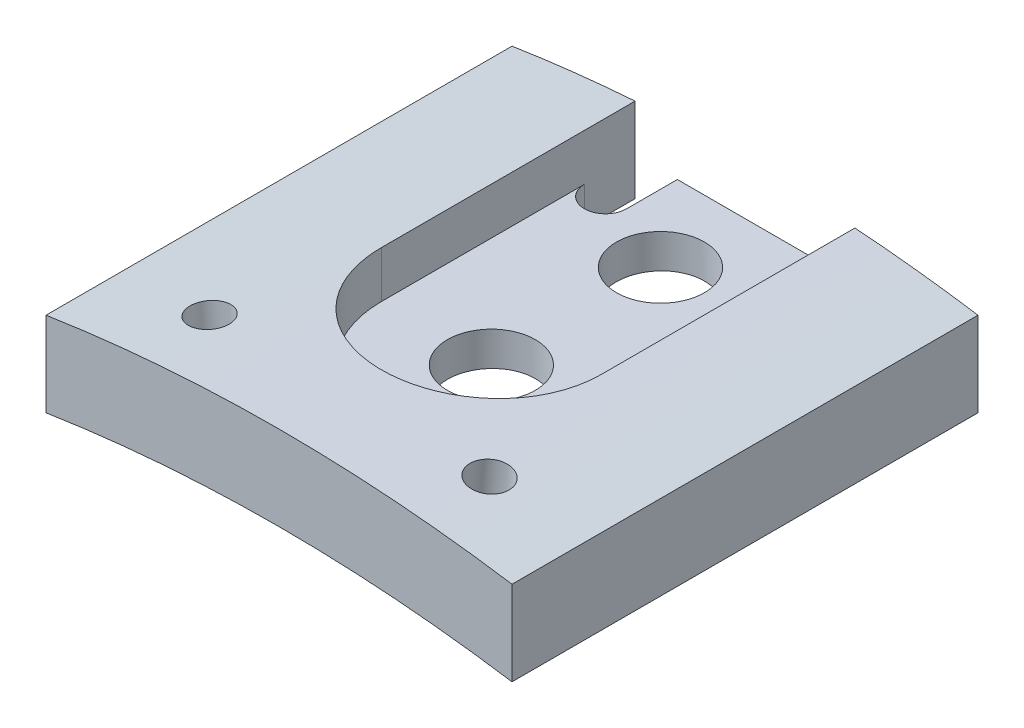
from build123d import *

# Parameters (mm, degrees)
BOSS_EXTRUDE1_DEPTH     = 35
CUT_EXTRUDE4_DEPTH      = 51.280392475
CUT_EXTRUDE4_DEPTH_BACK = 51.280392475
SKETCH6_R               = 1.4732
CUT_EXTRUDE5_DEPTH      = 51.935908437
CUT_EXTRUDE5_DEPTH_BACK = 51.935908437
SKETCH7_R               = 1.4732
CUT_EXTRUDE6_DEPTH      = 52.100782935
SKETCH10_R              = 3.302
CUT_EXTRUDE7_DEPTH      = 40.880823427
SKETCH10_3_R            = 3.302
CUT_EXTRUDE8_DEPTH      = 3.81
CUT_EXTRUDE9_DEPTH      = 50.649791979


with BuildPart() as part:
    # Sketch1 → Boss-Extrude1 (new body)
    with BuildSketch(Plane.XY):
        with BuildLine():
            Line((0, -12.7), (0, 0))
            Line((0, 0), (-35, 0))
            Line((-35, 0), (-35, -12.7))
            ThreePointArc((-35, -12.7), (-17.5, -11.353892856), (0, -12.7))
        make_face()
    extrude(amount=BOSS_EXTRUDE1_DEPTH)

    # Sketch6 → Cut-Extrude4 (cut, two sides: drawn at the far end of the back side and taken through both)
    with BuildSketch(Plane(origin=(-1.080773401, -12.353296496, 0), x_dir=(0.9961946980917455, -0.08715574274765824, 0), z_dir=(-0.08715574274765824, -0.9961946980917455, 0)).offset(-CUT_EXTRUDE4_DEPTH_BACK)):
        with Locations((-6.482080767, 29.70276)):
            Circle(SKETCH6_R)
    extrude(amount=CUT_EXTRUDE4_DEPTH + CUT_EXTRUDE4_DEPTH_BACK, mode=Mode.SUBTRACT)

    # Sketch7 → Cut-Extrude5 (cut, two sides: drawn at the far end of the back side and taken through both)
    with BuildSketch(Plane(origin=(0.814909078, -9.314453387, 0), x_dir=(0.9961946980917455, 0.08715574274765851, 0), z_dir=(0.08715574274765851, -0.9961946980917455, 0)).offset(-CUT_EXTRUDE5_DEPTH_BACK)):
        with Locations((-28.384733667, 29.70276)):
            Circle(SKETCH7_R)
    extrude(amount=CUT_EXTRUDE5_DEPTH + CUT_EXTRUDE5_DEPTH_BACK, mode=Mode.SUBTRACT)

    # Sketch8 → Cut-Extrude6 (cut, through all)
    with BuildSketch(Plane(origin=(0, 0, 0), x_dir=(-1, 0, 0), z_dir=(0, 0, -1))):
        with BuildLine():
            ThreePointArc((0, -6.35), (17.5, -5.003892856), (35, -6.35))
            Line((35, -6.35), (35, 0))
            Line((35, 0), (0, 0))
            Line((0, 0), (0, -6.35))
        make_face()
    extrude(amount=-CUT_EXTRUDE6_DEPTH, mode=Mode.SUBTRACT)

    # Sketch10 → Cut-Extrude7 (cut, through all)
    with BuildSketch(Plane(origin=(-17.5, -5.003892856, 0), x_dir=(-1, 0, 0), z_dir=(0, 1, 0))):
        with Locations((0, 19.05)):
            Circle(SKETCH10_R)
        with Locations((0, 6.35)):
            Circle(SKETCH10_R)
    extrude(amount=-CUT_EXTRUDE7_DEPTH, mode=Mode.SUBTRACT)

    # Sketch10<3> → Cut-Extrude8 (cut)
    with BuildSketch(Plane(origin=(-17.5, -5.003892856, 0), x_dir=(-1, 0, 0), z_dir=(0, 1, 0))):
        with BuildLine():
            Line((-8.255, 19.05), (-8.255, -2.465000046))
            Line((-8.255, -2.465000046), (8.255, -2.465000046))
            Line((8.255, -2.465000046), (8.255, 19.05))
            ThreePointArc((8.255, 19.05), (0, 27.305), (-8.255, 19.05))
        make_face()
        with Locations((0, 6.35)):
            Circle(SKETCH10_3_R, mode=Mode.SUBTRACT)
        with Locations((0, 19.05)):
            Circle(SKETCH10_3_R, mode=Mode.SUBTRACT)
    extrude(amount=-CUT_EXTRUDE8_DEPTH, mode=Mode.SUBTRACT)

    # Sketch11 → Cut-Extrude9 (cut, through all)
    with BuildSketch(Plane(origin=(0, -8.813892856, 0), x_dir=(1, 0, 0), z_dir=(0, 1, 0))):
        with BuildLine():
            Line((-22.58, -3.81), (-22.58, 0))
            Line((-22.58, 0), (-25.755, 0))
            Line((-25.755, 0), (-25.755, -3.81))
            ThreePointArc((-25.755, -3.81), (-24.1675, -5.3975), (-22.58, -3.81))
        make_face()
    extrude(amount=-CUT_EXTRUDE9_DEPTH, mode=Mode.SUBTRACT)


solid = part.part
